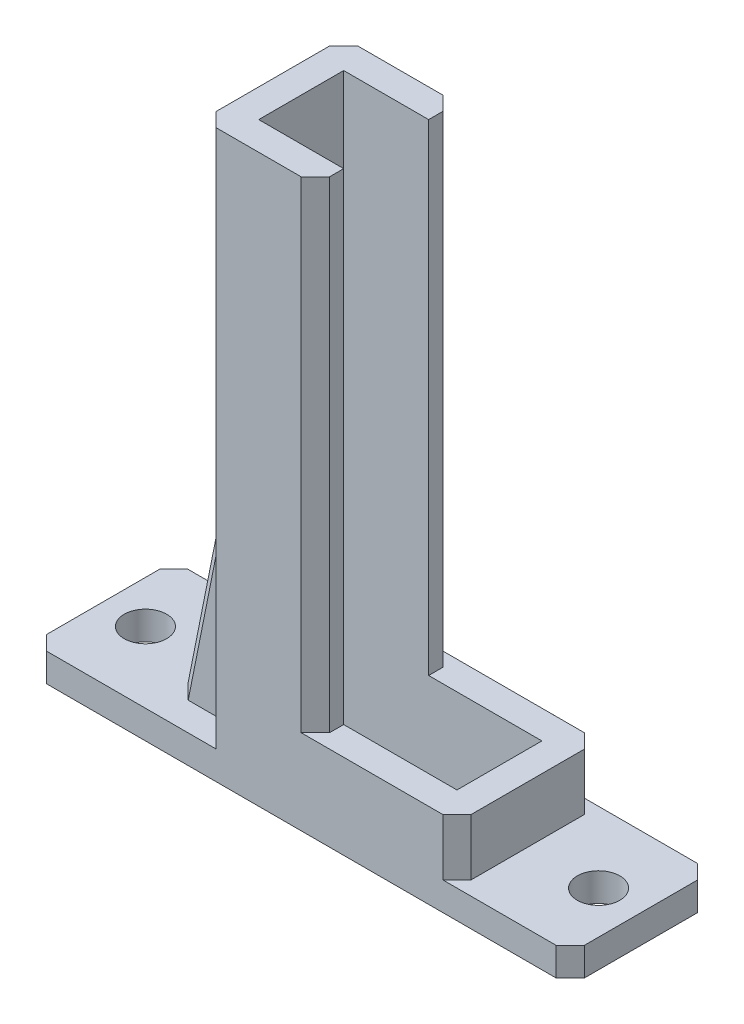
from build123d import *

# Parameters (mm, degrees)
SKETCH1_W                = 18
SKETCH1_H                = 10
SKETCH1_W_2              = 14
SKETCH1_H_2              = 6
BOSS_EXTRUDE1_DEPTH      = 6
BOSS_EXTRUDE2_DEPTH      = 34
SKETCH3_W                = 12
SKETCH3_H                = 10
SKETCH3_W_2              = 8
BOSS_EXTRUDE3_DEPTH      = 2
BOSS_EXTRUDE4_DEPTH      = 3
BOSS_EXTRUDE4_DEPTH_BACK = 3
CHAMFER1_SIZE            = 1
CHAMFER2_SIZE            = 1
SKETCH5_R                = 1.5
CUT_EXTRUDE1_DEPTH       = 48.116875958


with BuildPart() as part:
    # Sketch1 → Boss-Extrude1 (new body)
    with BuildSketch(Plane(origin=(0, 0, 0), x_dir=(1, 0, 0), z_dir=(0, 1, 0))):
        with Locations((9, 5)):
            Rectangle(SKETCH1_W, SKETCH1_H)
        with Locations((9, 5)):
            Rectangle(SKETCH1_W_2, SKETCH1_H_2, mode=Mode.SUBTRACT)
    extrude(amount=BOSS_EXTRUDE1_DEPTH)

    # Sketch2 → Boss-Extrude2 (add)
    with BuildSketch(Plane(origin=(0, 6, 0), x_dir=(1, 0, 0), z_dir=(0, 1, 0))):
        Polygon((0, 10), (0, 0), (8, 0), (8, 2), (2, 2), (2, 8), (8, 8), (8, 10), align=None)
    extrude(amount=BOSS_EXTRUDE2_DEPTH)

    # Sketch3 → Boss-Extrude3 (add)
    with BuildSketch(Plane(origin=(0, 0, 0), x_dir=(1, 0, 0), z_dir=(0, 1, 0))):
        with Locations((-6, 5)):
            Rectangle(SKETCH3_W, SKETCH3_H)
        with Locations((22, 5)):
            Rectangle(SKETCH3_W_2, SKETCH3_H)
    extrude(amount=BOSS_EXTRUDE3_DEPTH)

    # Sketch4 → Boss-Extrude4 (add, two sides: drawn at the far end of the back side and taken through both)
    with BuildSketch(Plane.XY.offset(-5).offset(-BOSS_EXTRUDE4_DEPTH_BACK)):
        Polygon((0, 2), (-4, 2), (0, 22), align=None)
    extrude(amount=BOSS_EXTRUDE4_DEPTH + BOSS_EXTRUDE4_DEPTH_BACK)

    # Chamfer1
    chamfer1_edges = [part.edges().sort_by_distance(p)[0] for p in [
        (8, 23, -10),
        (8, 23, 0),
        (-12, 1, -10),
        (-12, 1, 0),
        (26, 1, 0),
        (26, 1, -10),
        (0, 21, -10),
        (18, 4, -10),
        (18, 4, 0),
        (0, 21, 0),
    ]]
    chamfer(chamfer1_edges, length=CHAMFER1_SIZE)

    # Chamfer2
    chamfer2_edges = [part.edges().sort_by_distance(p)[0] for p in [
        (-2, 12, -8),
        (-2, 12, -2),
    ]]
    chamfer(chamfer2_edges, length=CHAMFER2_SIZE)

    # Sketch5 → Cut-Extrude1 (cut, through all)
    with BuildSketch(Plane(origin=(0, 2, 0), x_dir=(1, 0, 0), z_dir=(0, 1, 0))):
        with Locations(Location((-9, 5, 0), (0, 0, 270))):
            Circle(SKETCH5_R)
        with Locations(Location((23, 5, 0), (0, 0, 270))):
            Circle(SKETCH5_R)
    extrude(amount=-CUT_EXTRUDE1_DEPTH, mode=Mode.SUBTRACT)


solid = part.part
